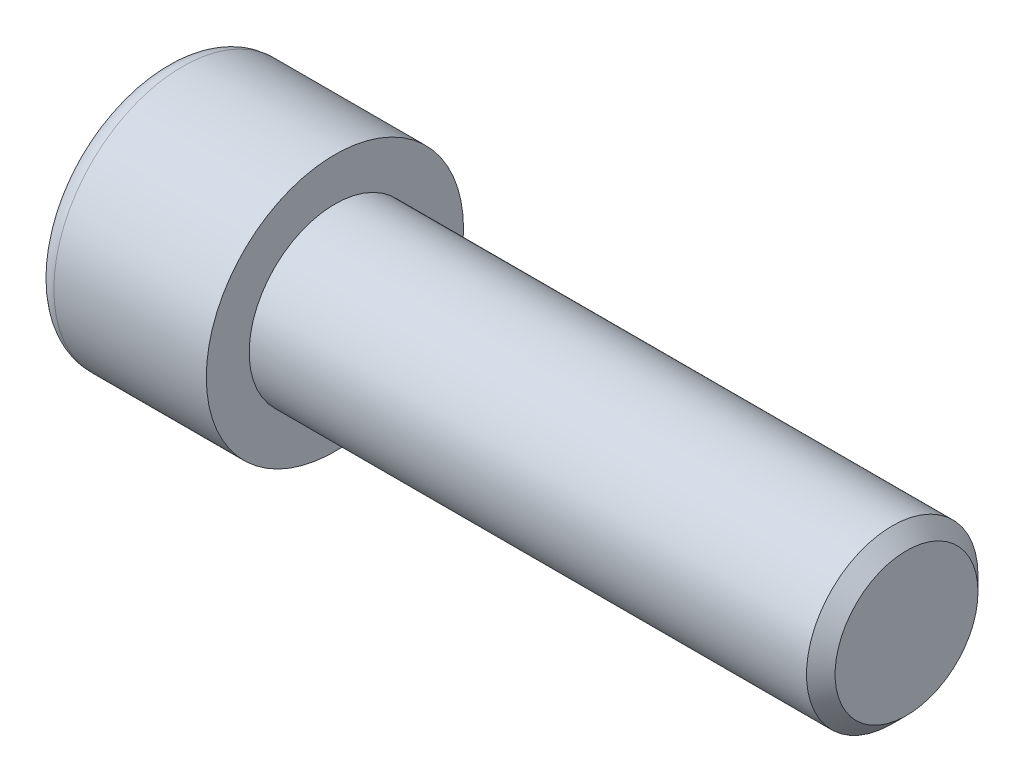
from build123d import *

# Parameters (mm, degrees)
CORTE_EXTRUS_O1_DEPTH            = 20
FURO_DE_DI_METRO_27_0_27_1_D     = 27
FURO_DE_DI_METRO_27_0_27_1_DEPTH = 5
FURO_DE_DI_METRO_27_0_27_1_TIP   = 8.111618357
FILETE1_R                        = 4
CHANFRO1_SIZE                    = 3


with BuildPart() as part:
    # Esboço1 → Revolução1 (revolve)
    with BuildSketch(Plane.XY, mode=Mode.PRIVATE) as revolu_o1_sk:
        Polygon((0, 0), (0, 27), (36, 27), (36, 18), (156, 18), (156, 0), align=None)
    revolve(revolu_o1_sk.sketch.rotate(Axis((156, 0, 0), (-1, 0, 0)), 90), axis=Axis((156, 0, 0), (-1, 0, 0)))

    # Esboço2 → Corte-extrusão1 (cut)
    with BuildSketch(Plane.ZY):
        Polygon((0, 15.588457268), (-13.5, 7.794228634), (-13.5, -7.794228634), (0, -15.588457268), (13.5, -7.794228634), (13.5, 7.794228634), align=None)
    extrude(amount=-CORTE_EXTRUS_O1_DEPTH, mode=Mode.SUBTRACT)

    # Furo de diâmetro Ø27.0 (27)1
    with Locations(Plane.ZY.offset(-20)):
        with Locations((0, 0)):
            Hole(FURO_DE_DI_METRO_27_0_27_1_D / 2, depth=FURO_DE_DI_METRO_27_0_27_1_DEPTH)
            with Locations((0, 0, -(FURO_DE_DI_METRO_27_0_27_1_DEPTH + FURO_DE_DI_METRO_27_0_27_1_TIP / 2))):  # 118° drill point
                Cone(0, FURO_DE_DI_METRO_27_0_27_1_D / 2, FURO_DE_DI_METRO_27_0_27_1_TIP, mode=Mode.SUBTRACT)

    # Filete1
    filete1_edges = [part.edges().sort_by_distance(p)[0] for p in [
        (0, 0, 27),
    ]]
    fillet(filete1_edges, radius=FILETE1_R)

    # Chanfro1
    chanfro1_edges = [part.edges().sort_by_distance(p)[0] for p in [
        (156, 0, 18),
    ]]
    chamfer(chanfro1_edges, length=CHANFRO1_SIZE)


solid = part.part
